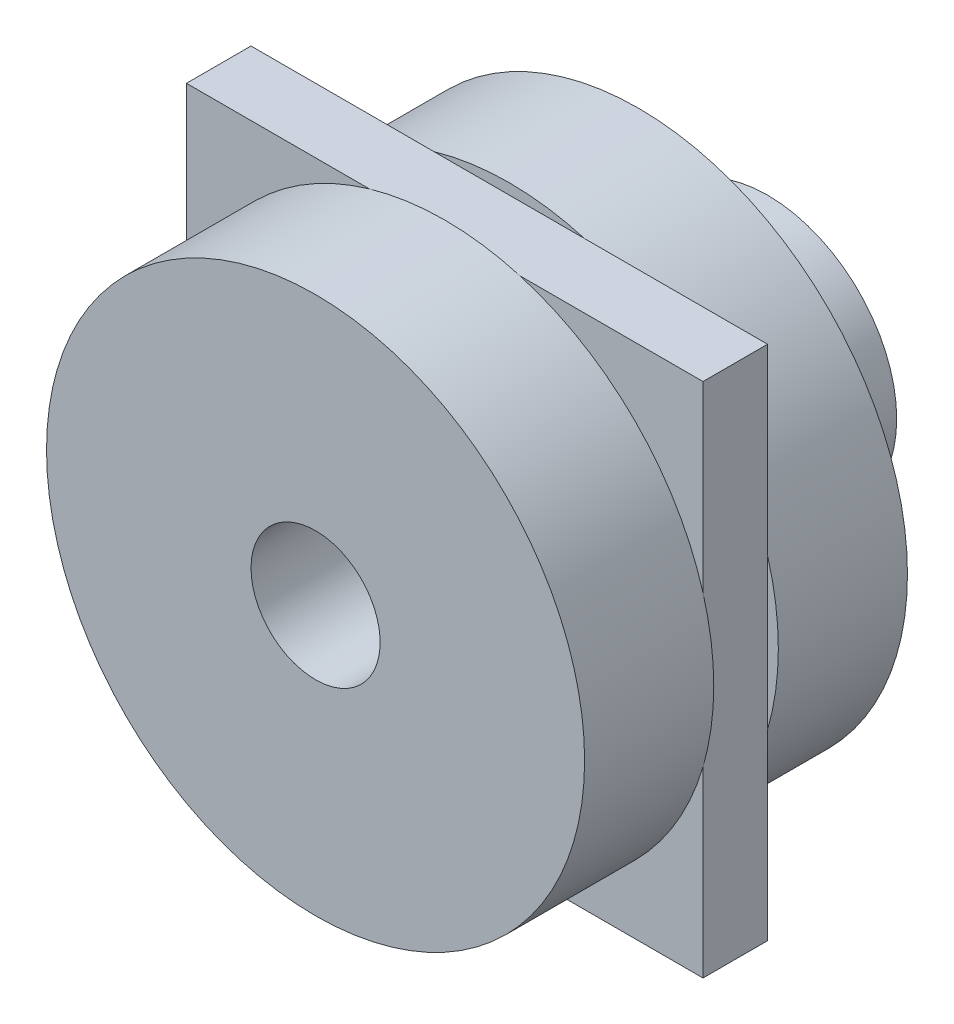
from build123d import *

# Parameters (mm, degrees)
SKETCH_1_R          = 12.5
EXTRUDE_1_DEPTH     = 6
SKETCH_2_R          = 6
EXTRUDE_2_DEPTH     = 6
SKETCH_3_W          = 24
SKETCH_3_H          = 24
EXTRUDE_3_DEPTH     = 3
SKETCH_4_R          = 12.5
EXTRUDE_4_DEPTH     = 6
SKETCH_937_R        = 3
CUT_EXTRUDE_1_DEPTH = 28.449954463


with BuildPart() as part:
    # Эскиз1 → Бобышка-Вытянуть1 (new body)
    with BuildSketch(Plane.XY):
        Circle(SKETCH_1_R)
    extrude(amount=EXTRUDE_1_DEPTH)

    # Эскиз2 → Бобышка-Вытянуть2 (add)
    with BuildSketch(Plane(origin=(0, 0, 0), x_dir=(-1, 0, 0), z_dir=(0, 0, -1))):
        with Locations(Location((0, 0, 0), (0, 0, 180))):
            Circle(SKETCH_2_R)
    extrude(amount=EXTRUDE_2_DEPTH)

    # Эскиз3 → Бобышка-Вытянуть3 (add)
    with BuildSketch(Plane.XY.offset(6)):
        Rectangle(SKETCH_3_W, SKETCH_3_H)
    extrude(amount=EXTRUDE_3_DEPTH)

    # Эскиз4 → Бобышка-Вытянуть4 (add)
    with BuildSketch(Plane.XY.offset(9)):
        with Locations(Location((0, 0, 0), (0, 0, 196.260204708))):
            Circle(SKETCH_4_R)
    extrude(amount=EXTRUDE_4_DEPTH)

    # Sketch 937 → Вырез-Вытянуть1 (cut, through all)
    with BuildSketch(Plane(origin=(0, 0, -6), x_dir=(-1, 0, 0), z_dir=(0, 0, -1))):
        Circle(SKETCH_937_R)
    extrude(amount=-CUT_EXTRUDE_1_DEPTH, mode=Mode.SUBTRACT)


solid = part.part
